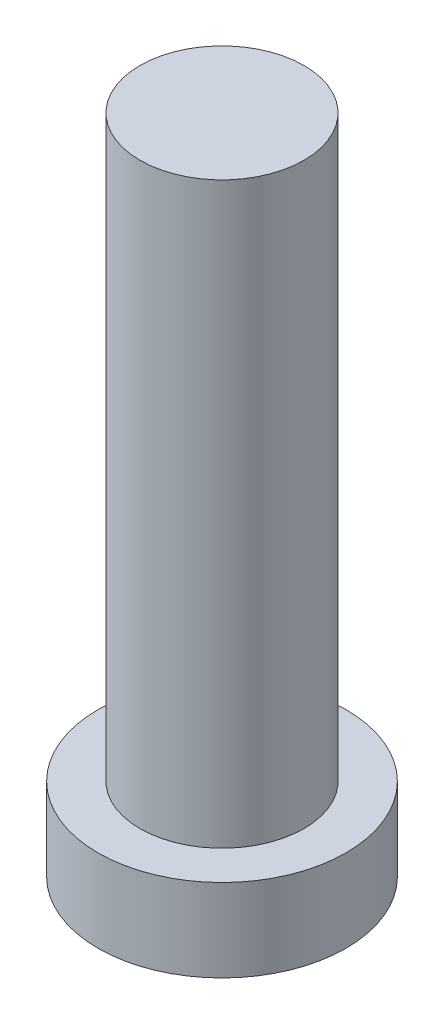
from build123d import *

# Parameters (mm, degrees)
SKETCH1_R           = 15
BOSS_EXTRUDE1_DEPTH = 10
SKETCH2_R           = 9.925
BOSS_EXTRUDE2_DEPTH = 70


with BuildPart() as part:
    # Sketch1 → Boss-Extrude1 (new body)
    with BuildSketch(Plane(origin=(0, 0, 0), x_dir=(1, 0, 0), z_dir=(0, 1, 0))):
        with Locations(Location((0, 0, 0), (0, 0, 270))):
            Circle(SKETCH1_R)
    extrude(amount=BOSS_EXTRUDE1_DEPTH)

    # Sketch2 → Boss-Extrude2 (add)
    with BuildSketch(Plane(origin=(0, 10, 0), x_dir=(1, 0, 0), z_dir=(0, 1, 0))):
        with Locations(Location((0, 0, 0), (0, 0, 270))):
            Circle(SKETCH2_R)
    extrude(amount=BOSS_EXTRUDE2_DEPTH)


solid = part.part
